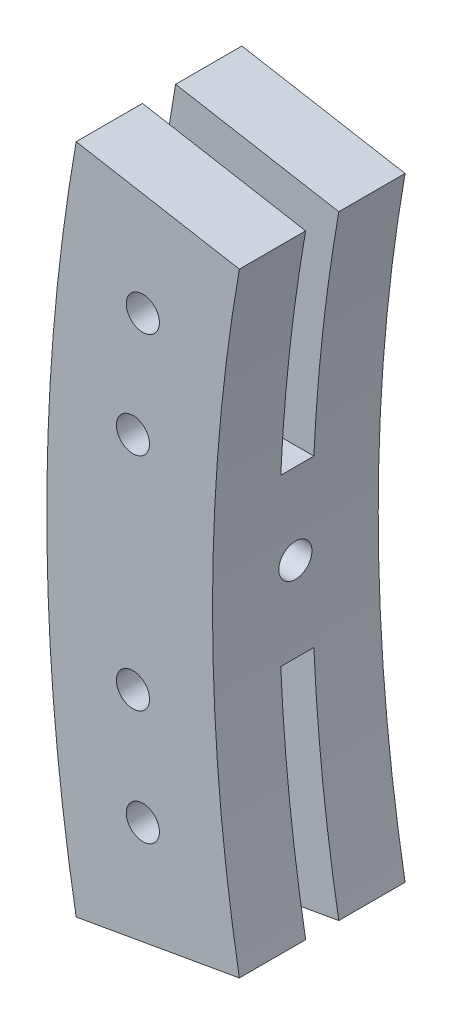
from build123d import *

# Parameters (mm, degrees)
BOSS_EXTRUDE3_DEPTH     = 7.5
CUT_EXTRUDE4_DEPTH      = 1.5
BOSS_EXTRUDE5_DEPTH     = 1.5
SKETCH4_R               = 3
BEARING_HOLE_DEPTH      = 1.25
SHAFT_HOLE_DEPTH        = 33.837885572
SHAFT_HOLE_DEPTH_BACK   = 2.5
SKETCH7_R               = 1.5
CUT_EXTRUDE6_DEPTH      = 178.77712661
CUT_EXTRUDE6_DEPTH_BACK = 178.77712661
SKETCH8_R               = 1.5


with BuildPart() as part:
    # Sketch1 → Boss-Extrude3 (new, symmetric)
    with BuildSketch(Plane.XY):
        with BuildLine():
            ThreePointArc((-157.569240482, -27.783708427), (-160, 0), (-157.569240482, 27.783708427))
            Line((-157.569240482, 27.783708427), (-172.341356777, 30.388431092))
            ThreePointArc((-172.341356777, 30.388431092), (-175, 0), (-172.341356777, -30.388431092))
            Line((-172.341356777, -30.388431092), (-157.569240482, -27.783708427))
        make_face()
    extrude(amount=BOSS_EXTRUDE3_DEPTH, both=True)

    # Sketch1<6> → Cut-Extrude4 (cut, symmetric)
    with BuildSketch(Plane.XY):
        with BuildLine():
            Line((-157.569240482, 27.783708427), (-172.341356777, 30.388431092))
            ThreePointArc((-172.341356777, 30.388431092), (-175, 0), (-172.341356777, -30.388431092))
            Line((-172.341356777, -30.388431092), (-157.569240482, -27.783708427))
            ThreePointArc((-157.569240482, -27.783708427), (-160, 0), (-157.569240482, 27.783708427))
        make_face()
    extrude(amount=CUT_EXTRUDE4_DEPTH, both=True, mode=Mode.SUBTRACT)


with BuildPart() as cut_extrude4_piece_1:
    # of the separate pieces the step leaves, piece 1, a body of its own (cut_extrude4_pieces)
    add(part.part.solids().sort_by_distance((-157.569240482, -27.783708427, -1.5))[0])



with BuildPart() as cut_extrude4_piece_2:
    # of the separate pieces the step leaves, piece 2, a body of its own (cut_extrude4_pieces)
    add(part.part.solids().sort_by_distance((-157.569240482, -27.783708427, 7.5))[0])


with BuildPart() as cut_extrude4_piece_1_1:
    add(cut_extrude4_piece_1.part)

    add(cut_extrude4_piece_2.part)  # Boss-Extrude5 merges Cut-Extrude4 piece 2
    # Sketch6 → Boss-Extrude5 (add, symmetric)
    with BuildSketch(Plane.XY):
        with BuildLine():
            Line((-159.824122084, 7.5), (-174.839211849, 7.5))
            ThreePointArc((-174.839211849, 7.5), (-175, 0), (-174.839211849, -7.5))
            Line((-174.839211849, -7.5), (-159.824122084, -7.5))
            ThreePointArc((-159.824122084, -7.5), (-160, 0), (-159.824122084, 7.5))
        make_face()
    extrude(amount=BOSS_EXTRUDE5_DEPTH, both=True)

    # Sketch4 → bearing hole (cut, symmetric)
    with BuildSketch(Plane(origin=(-167.5, 0, 0), x_dir=(0, 0, -1), z_dir=(1, 0, 0))):
        Circle(SKETCH4_R)
    extrude(amount=BEARING_HOLE_DEPTH, both=True, mode=Mode.SUBTRACT)

    # Sketch7 → shaft hole (cut, two sides: drawn at the far end of the back side and taken through both)
    with BuildSketch(Plane(origin=(-167.5, 0, 0), x_dir=(0, 0, -1), z_dir=(1, 0, 0)).offset(-SHAFT_HOLE_DEPTH_BACK)):
        Circle(SKETCH7_R)
    extrude(amount=SHAFT_HOLE_DEPTH + SHAFT_HOLE_DEPTH_BACK, mode=Mode.SUBTRACT)

    # Sketch8 → Cut-Extrude6 (cut, two sides: drawn at the far end of the back side and taken through both)
    with BuildSketch(Plane.XY.offset(-CUT_EXTRUDE6_DEPTH_BACK)):
        with Locations((-166.306502189, 19.95989303)):
            Circle(SKETCH8_R)
        with Locations((-167.201226072, 10)):
            Circle(SKETCH8_R)
        with Locations((-167.201226072, -10)):
            Circle(SKETCH8_R)
        with Locations((-166.306502189, -19.95989303)):
            Circle(SKETCH8_R)
    extrude(amount=CUT_EXTRUDE6_DEPTH + CUT_EXTRUDE6_DEPTH_BACK, mode=Mode.SUBTRACT)


solid = cut_extrude4_piece_1_1.part
